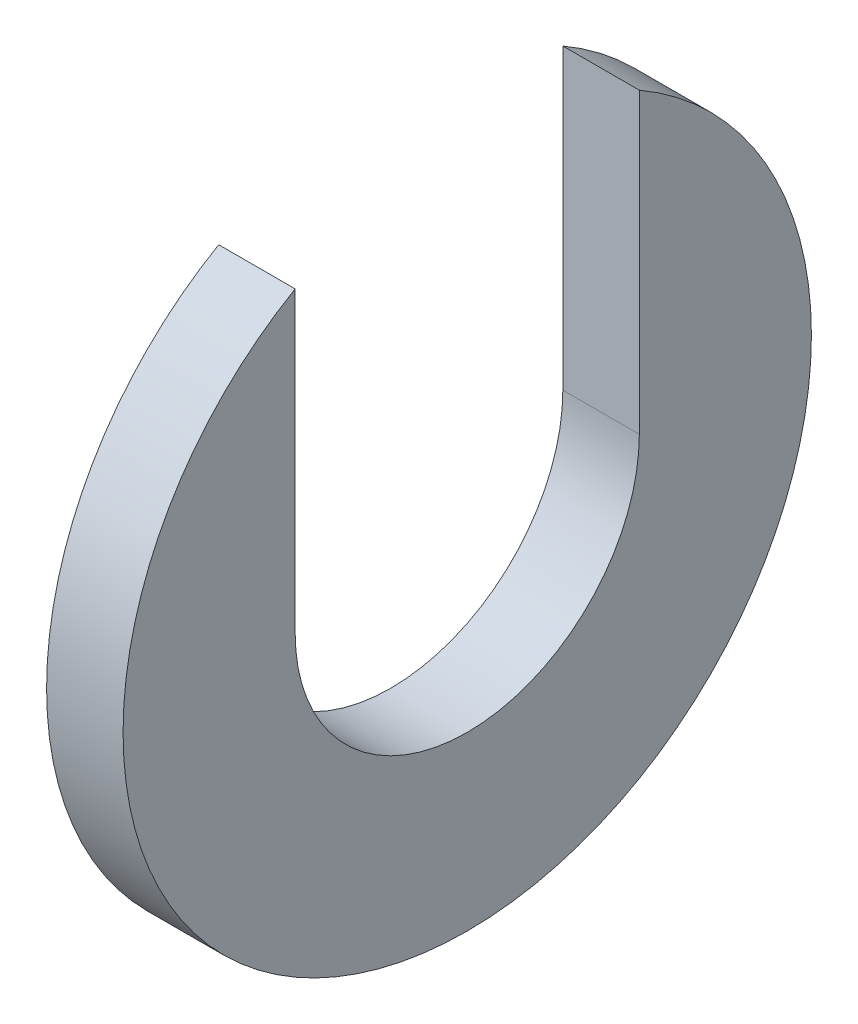
from build123d import *

# Parameters (mm, degrees)
SKETCH1_R               = 9
SKETCH1_R_2             = 4.5
BOSS_EXTRUDE1_DEPTH     = 1
SKETCH3_W               = 2
SKETCH3_H               = 9
CUT_EXTRUDE_THIN1_DEPTH = 13.767145335


with BuildPart() as part:
    # Sketch1 → Boss-Extrude1 (new, symmetric)
    with BuildSketch(Plane(origin=(0, 0, 0), x_dir=(0, 0, -1), z_dir=(1, 0, 0))):
        Circle(SKETCH1_R)
        Circle(SKETCH1_R_2, mode=Mode.SUBTRACT)
    extrude(amount=BOSS_EXTRUDE1_DEPTH, both=True)

    # Sketch3 → Cut-Extrude-Thin1 (cut, through all)
    with BuildSketch(Plane(origin=(0, 0, 0), x_dir=(1, 0, 0), z_dir=(0, 1, 0))):
        Rectangle(SKETCH3_W, SKETCH3_H)
    extrude(amount=CUT_EXTRUDE_THIN1_DEPTH, mode=Mode.SUBTRACT)


solid = part.part
